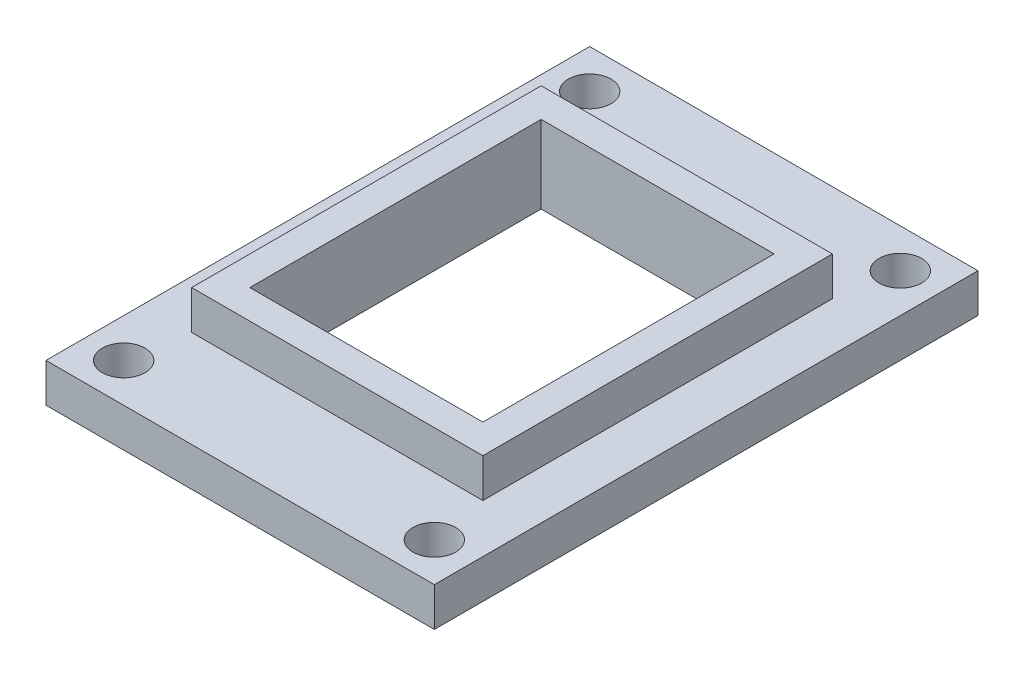
from build123d import *

# Parameters (mm, degrees)
SKETCH1_W           = 19.05
SKETCH1_H           = 22.86
SKETCH1_W_2         = 15.24
SKETCH1_H_2         = 19.05
BOSS_EXTRUDE1_DEPTH = 5.08
SKETCH3_W           = 25.4
SKETCH3_H           = 35.56
SKETCH3_R           = 1.397
SKETCH3_W_2         = 19.05
SKETCH3_H_2         = 22.86
BOSS_EXTRUDE2_DEPTH = 2.54


with BuildPart() as part:
    # Sketch1 → Boss-Extrude1 (new body)
    with BuildSketch(Plane(origin=(0, 0, 0), x_dir=(1, 0, 0), z_dir=(0, 1, 0))):
        Rectangle(SKETCH1_W, SKETCH1_H)
        Rectangle(SKETCH1_W_2, SKETCH1_H_2, mode=Mode.SUBTRACT)
    extrude(amount=BOSS_EXTRUDE1_DEPTH)

    # Sketch3 → Boss-Extrude2 (add)
    with BuildSketch(Plane(origin=(0, 0, 0), x_dir=(1, 0, 0), z_dir=(0, 1, 0))):
        Rectangle(SKETCH3_W, SKETCH3_H)
        with Locations(Location((-10.16, 15.24, 0), (0, 0, 270))):
            Circle(SKETCH3_R, mode=Mode.SUBTRACT)
        with Locations(Location((10.16, 15.24, 0), (0, 0, 90))):
            Circle(SKETCH3_R, mode=Mode.SUBTRACT)
        with Locations(Location((-10.16, -15.24, 0), (0, 0, 90))):
            Circle(SKETCH3_R, mode=Mode.SUBTRACT)
        with Locations(Location((10.16, -15.24, 0), (0, 0, 270))):
            Circle(SKETCH3_R, mode=Mode.SUBTRACT)
        Rectangle(SKETCH3_W_2, SKETCH3_H_2, mode=Mode.SUBTRACT)
    extrude(amount=BOSS_EXTRUDE2_DEPTH)


solid = part.part
